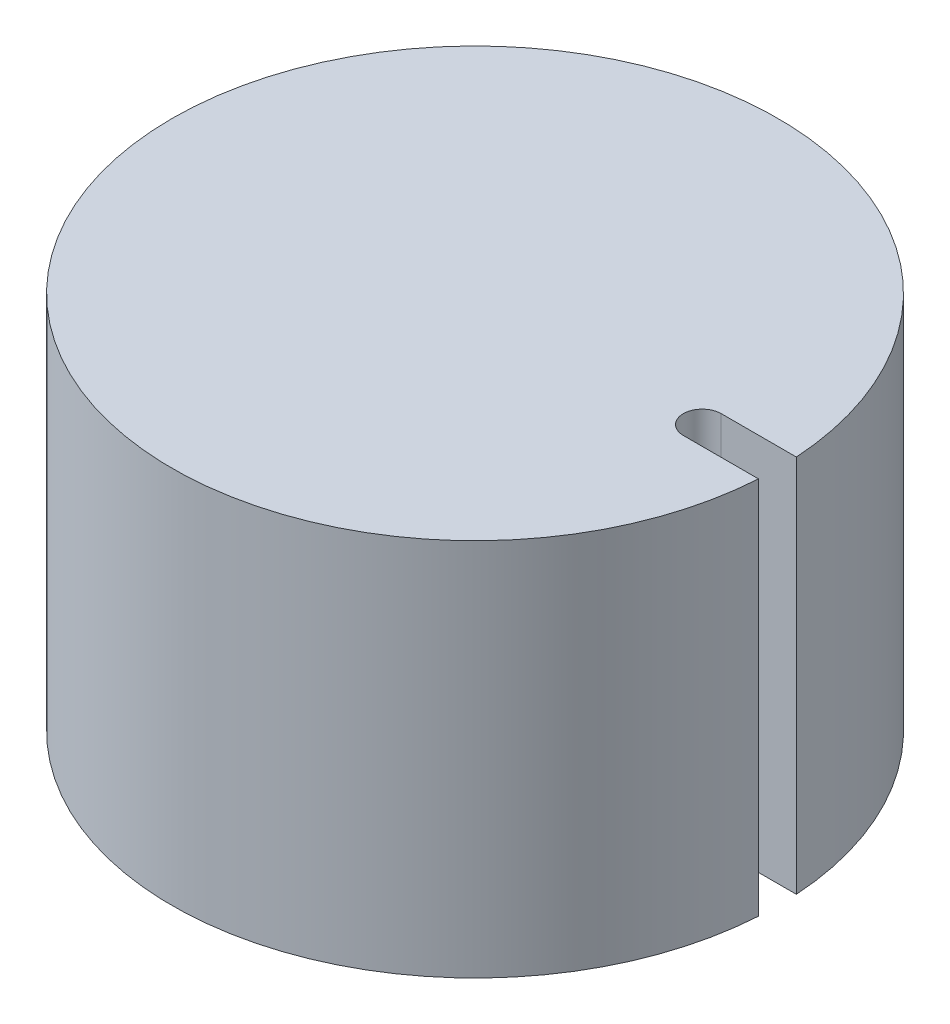
from build123d import *

# Parameters (mm, degrees)
SKETCH_1_R          = 40
EXTRUDE_1_DEPTH     = 50
CUT_EXTRUDE_1_DEPTH = 30
CUT_EXTRUDE_2_DEPTH = 76.498344353


with BuildPart() as part:
    # 草图1 → 凸台-拉伸1 (new body)
    with BuildSketch(Plane(origin=(0, 0, 0), x_dir=(1, 0, 0), z_dir=(0, 1, 0))):
        Circle(SKETCH_1_R)
    extrude(amount=EXTRUDE_1_DEPTH)

    # 草图2 → 切除-拉伸1 (cut)
    with BuildSketch(Plane.XZ):
        with BuildLine():
            Line((18.540496218, 7.5), (25, 7.5))
            Line((25, 7.5), (25, -7.5))
            Line((25, -7.5), (18.540496218, -7.5))
            ThreePointArc((18.540496218, -7.5), (-20, 0), (18.540496218, 7.5))
        make_face()
    extrude(amount=-CUT_EXTRUDE_1_DEPTH, mode=Mode.SUBTRACT)

    # 草图4 → 切除-拉伸2 (cut, through all)
    with BuildSketch(Plane.XZ):
        with BuildLine():
            Line((40, -2.5), (30, -2.5))
            ThreePointArc((30, -2.5), (27.5, 0), (30, 2.5))
            Line((30, 2.5), (40, 2.5))
            ThreePointArc((40, 2.5), (42.5, 0), (40, -2.5))
        make_face()
    extrude(amount=-CUT_EXTRUDE_2_DEPTH, mode=Mode.SUBTRACT)


solid = part.part
